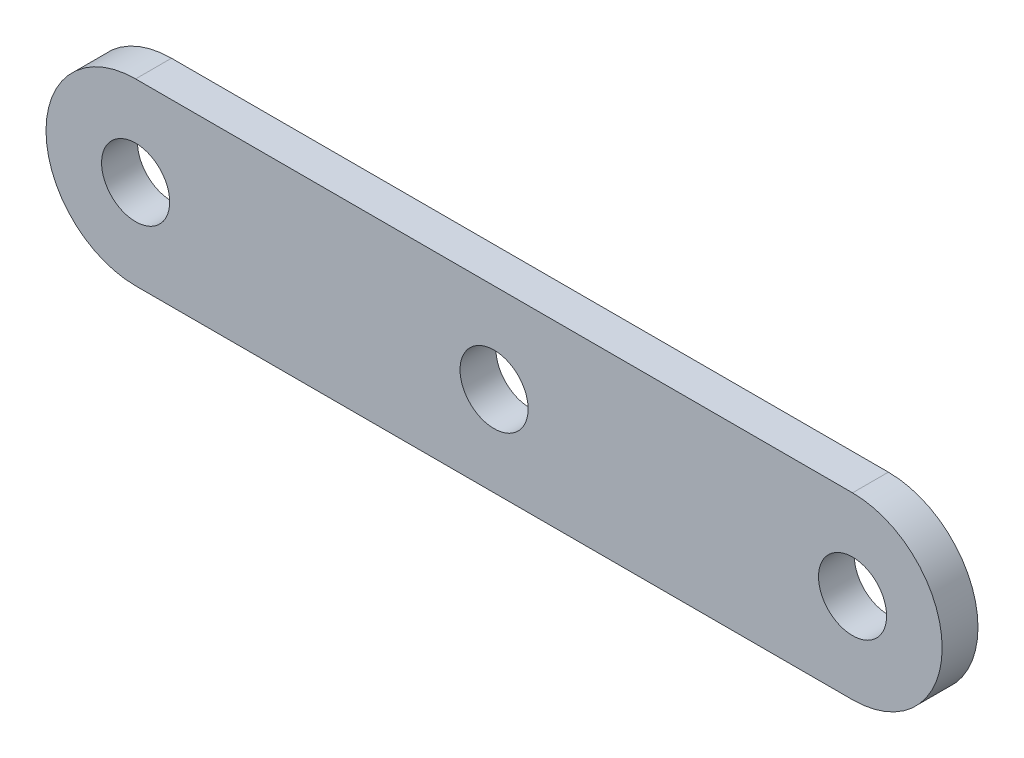
from build123d import *

# Parameters (mm, degrees)
BOSS_EXTRUDE1_DEPTH = 2.54
SKETCH2_R           = 2.413
CUT_EXTRUDE1_DEPTH  = 33.478248105
LPATTERN1_COUNT     = 3
LPATTERN1_PITCH     = 25.4


with BuildPart() as part:
    # Sketch1 → Boss-Extrude1 (new body)
    with BuildSketch(Plane.XY):
        with BuildLine():
            Line((-25.4, 6.35), (25.4, 6.35))
            ThreePointArc((25.4, 6.35), (31.75, 0), (25.4, -6.35))
            Line((25.4, -6.35), (-25.4, -6.35))
            ThreePointArc((-25.4, -6.35), (-31.75, 0), (-25.4, 6.35))
        make_face()
    extrude(amount=BOSS_EXTRUDE1_DEPTH)

    # Sketch2 → Cut-Extrude1 (cut, through all)
    with BuildSketch(Plane.XY.offset(2.54)):
        with Locations((-25.4, 0)):
            Circle(SKETCH2_R)
    cut_extrude1 = extrude(amount=-CUT_EXTRUDE1_DEPTH, mode=Mode.SUBTRACT)

    # LPattern1: Cut-Extrude1 ×3
    with Locations(*[(i * LPATTERN1_PITCH, 0, 0) for i in range(1, LPATTERN1_COUNT)]):
        add(cut_extrude1, mode=Mode.SUBTRACT)


solid = part.part
